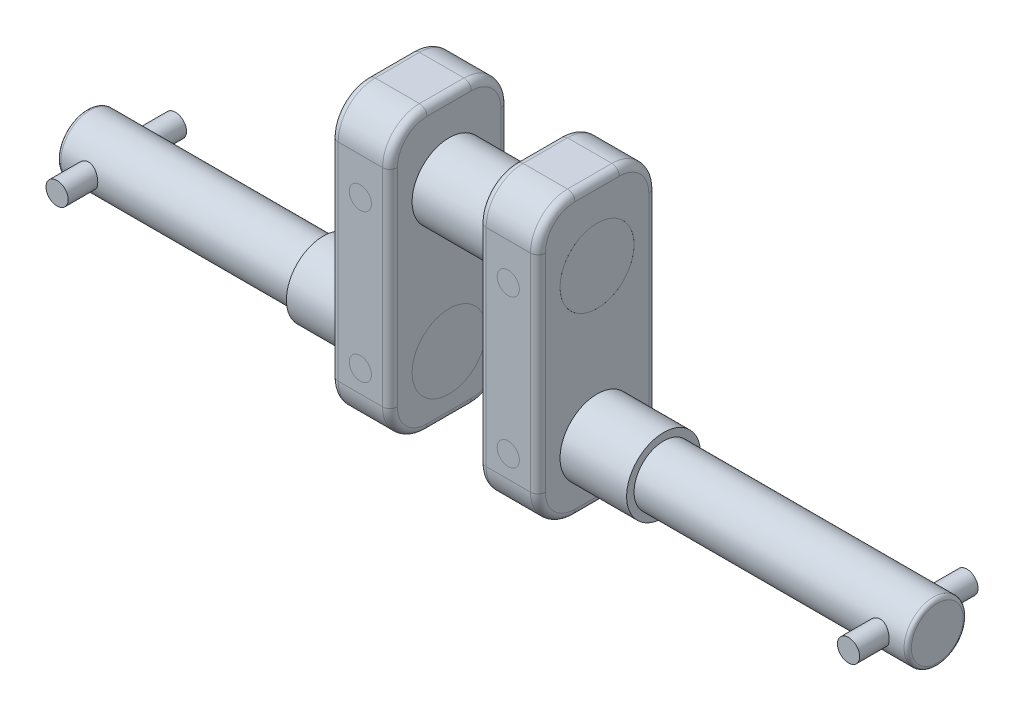
from build123d import *

# Parameters (mm, degrees)
SKETCH1_R             = 4
BOSS_EXTRUDE1_DEPTH   = 32
SKETCH2_R             = 5
BOSS_EXTRUDE2_DEPTH   = 17
SKETCH3_R             = 5
BOSS_EXTRUDE3_DEPTH   = 8
SKETCH4_R             = 5
BOSS_EXTRUDE4_DEPTH   = 28
SKETCH5_R             = 4
BOSS_EXTRUDE5_DEPTH   = 37
SKETCH6_R             = 1.5
CUT_EXTRUDE1_DEPTH    = 120.920807202
SKETCH6_2_R           = 1.5
BOSS_EXTRUDE6_DEPTH   = 16
BOSS_EXTRUDE6_2_DEPTH = 16
BOSS_EXTRUDE6_3_DEPTH = 16
BOSS_EXTRUDE6_4_DEPTH = 16
BOSS_EXTRUDE6_5_DEPTH = 16
BOSS_EXTRUDE6_6_DEPTH = 16
FILLET1_R             = 1
FILLET2_R             = 1
FILLET3_R             = 0.5
FILLET4_R             = 0.5


with BuildPart() as part:
    # Sketch1 → Boss-Extrude1 (new body)
    with BuildSketch(Plane(origin=(0, 0, 0), x_dir=(0, 0, -1), z_dir=(1, 0, 0))):
        Circle(SKETCH1_R)
    extrude(amount=BOSS_EXTRUDE1_DEPTH)


with BuildPart() as body_2:
    # Sketch2 → Boss-Extrude2 (new body)
    with BuildSketch(Plane(origin=(32, 0, 0), x_dir=(0, 0, -1), z_dir=(1, 0, 0))):
        Circle(SKETCH2_R)
    extrude(amount=BOSS_EXTRUDE2_DEPTH)


with BuildPart() as body_3:
    # Sketch3 → Boss-Extrude3 (new body)
    with BuildSketch(Plane(origin=(49, 0, 0), x_dir=(0, 0, -1), z_dir=(1, 0, 0))):
        with BuildLine():
            Line((-3, -8), (3, -8))
            ThreePointArc((3, -8), (6.535533906, -6.535533906), (8, -3))
            Line((8, -3), (8, 25))
            ThreePointArc((8, 25), (6.535533906, 28.535533906), (3, 30))
            Line((3, 30), (-3, 30))
            ThreePointArc((-3, 30), (-6.535533906, 28.535533906), (-8, 25))
            Line((-8, 25), (-8, -3))
            ThreePointArc((-8, -3), (-6.535533906, -6.535533906), (-3, -8))
        make_face()
        Circle(SKETCH3_R, mode=Mode.SUBTRACT)
        with Locations((0, 20)):
            Circle(SKETCH3_R, mode=Mode.SUBTRACT)
    extrude(amount=-BOSS_EXTRUDE3_DEPTH)


with BuildPart() as body_4:
    # Sketch4 → Boss-Extrude4 (new body)
    with BuildSketch(Plane.ZY.offset(-41)):
        with Locations((0, 20)):
            Circle(SKETCH4_R)
    extrude(amount=-BOSS_EXTRUDE4_DEPTH)


with BuildPart() as body_5:
    # Mirror1: mirrored copy
    add(body_3.part.mirror(Plane.ZY.offset(-55)))


with BuildPart() as body_6:
    # Mirror1 2: mirrored copy
    add(body_2.part.mirror(Plane.ZY.offset(-55)))

    # Sketch5 → Boss-Extrude5 (add)
    with BuildSketch(Plane(origin=(78, 0, 0), x_dir=(0, 0, -1), z_dir=(1, 0, 0))):
        Circle(SKETCH5_R)
    extrude(amount=BOSS_EXTRUDE5_DEPTH)


with BuildPart() as cut_extrude1_tool:
    # Sketch6 → Cut-Extrude1 (new, through all)
    with BuildSketch(Plane.XY.offset(8)):
        with Locations((4, 0)):
            Circle(SKETCH6_R)
        with Locations((45, 0)):
            Circle(SKETCH6_R)
        with Locations((65, 0)):
            Circle(SKETCH6_R)
        with Locations((111, 0)):
            Circle(SKETCH6_R)
        with Locations((65, 20)):
            Circle(SKETCH6_R)
        with Locations((45, 20)):
            Circle(SKETCH6_R)
    extrude(amount=-CUT_EXTRUDE1_DEPTH)


with BuildPart() as part_1:
    add(part.part)

    # Cut-Extrude1: cut by cut_extrude1_tool
    add(cut_extrude1_tool.part, mode=Mode.SUBTRACT)

    # Fillet3
    fillet3_edges = [part_1.edges().sort_by_distance(p)[0] for p in [
        (0, 0, 4),
    ]]
    fillet(fillet3_edges, radius=FILLET3_R)


with BuildPart() as body_2_1:
    add(body_2.part)

    # Cut-Extrude1: cut by cut_extrude1_tool
    add(cut_extrude1_tool.part, mode=Mode.SUBTRACT)


with BuildPart() as body_3_1:
    add(body_3.part)

    # Cut-Extrude1: cut by cut_extrude1_tool
    add(cut_extrude1_tool.part, mode=Mode.SUBTRACT)

    # Fillet1
    fillet1_edges = [body_3_1.edges().sort_by_distance(p)[0] for p in [
        (41, -6.535533906, -6.535533906),
        (41, -8, 0),
        (41, -6.535533906, 6.535533906),
        (41, 11, 8),
        (41, 28.535533906, 6.535533906),
        (41, 30, 0),
        (41, 28.535533906, -6.535533906),
        (49, 28.535533906, 6.535533906),
        (49, 30, 0),
        (49, 28.535533906, -6.535533906),
        (49, 11, -8),
        (49, -6.535533906, -6.535533906),
        (49, -8, 0),
        (49, -6.535533906, 6.535533906),
        (41, 11, -8),
        (49, 11, 8),
    ]]
    fillet(fillet1_edges, radius=FILLET1_R)


with BuildPart() as body_4_1:
    add(body_4.part)

    # Cut-Extrude1: cut by cut_extrude1_tool
    add(cut_extrude1_tool.part, mode=Mode.SUBTRACT)


with BuildPart() as body_5_1:
    add(body_5.part)

    # Cut-Extrude1: cut by cut_extrude1_tool
    add(cut_extrude1_tool.part, mode=Mode.SUBTRACT)

    # Fillet2
    fillet2_edges = [body_5_1.edges().sort_by_distance(p)[0] for p in [
        (69, -6.535533906, -6.535533906),
        (69, -8, 0),
        (69, -6.535533906, 6.535533906),
        (69, 11, 8),
        (69, 28.535533906, 6.535533906),
        (69, 30, 0),
        (69, 28.535533906, -6.535533906),
        (61, -6.535533906, -6.535533906),
        (61, -8, 0),
        (61, -6.535533906, 6.535533906),
        (61, 11, 8),
        (61, 28.535533906, 6.535533906),
        (61, 30, 0),
        (61, 28.535533906, -6.535533906),
        (69, 11, -8),
        (61, 11, -8),
    ]]
    fillet(fillet2_edges, radius=FILLET2_R)


with BuildPart() as body_6_1:
    add(body_6.part)

    # Cut-Extrude1: cut by cut_extrude1_tool
    add(cut_extrude1_tool.part, mode=Mode.SUBTRACT)

    # Fillet4
    fillet4_edges = [body_6_1.edges().sort_by_distance(p)[0] for p in [
        (115, 0, 4),
    ]]
    fillet(fillet4_edges, radius=FILLET4_R)


with BuildPart() as body_7:
    # Sketch6<2> → Boss-Extrude6 (new body)
    with BuildSketch(Plane.XY.offset(8)):
        with Locations((4, 0)):
            Circle(SKETCH6_2_R)
    extrude(amount=-BOSS_EXTRUDE6_DEPTH)


with BuildPart() as body_8:
    # Sketch6<2> → Boss-Extrude6 2 (new body)
    with BuildSketch(Plane.XY.offset(8)):
        with Locations((45, 0)):
            Circle(SKETCH6_2_R)
    extrude(amount=-BOSS_EXTRUDE6_2_DEPTH)


with BuildPart() as body_9:
    # Sketch6<2> → Boss-Extrude6 3 (new body)
    with BuildSketch(Plane.XY.offset(8)):
        with Locations((65, 0)):
            Circle(SKETCH6_2_R)
    extrude(amount=-BOSS_EXTRUDE6_3_DEPTH)


with BuildPart() as body_10:
    # Sketch6<2> → Boss-Extrude6 4 (new body)
    with BuildSketch(Plane.XY.offset(8)):
        with Locations((111, 0)):
            Circle(SKETCH6_2_R)
    extrude(amount=-BOSS_EXTRUDE6_4_DEPTH)


with BuildPart() as body_11:
    # Sketch6<2> → Boss-Extrude6 5 (new body)
    with BuildSketch(Plane.XY.offset(8)):
        with Locations((65, 20)):
            Circle(SKETCH6_2_R)
    extrude(amount=-BOSS_EXTRUDE6_5_DEPTH)


with BuildPart() as body_12:
    # Sketch6<2> → Boss-Extrude6 6 (new body)
    with BuildSketch(Plane.XY.offset(8)):
        with Locations((45, 20)):
            Circle(SKETCH6_2_R)
    extrude(amount=-BOSS_EXTRUDE6_6_DEPTH)


solid = Compound([part_1.part, body_2_1.part, body_3_1.part, body_4_1.part, body_5_1.part, body_6_1.part, body_7.part, body_8.part, body_9.part, body_10.part, body_11.part, body_12.part])
